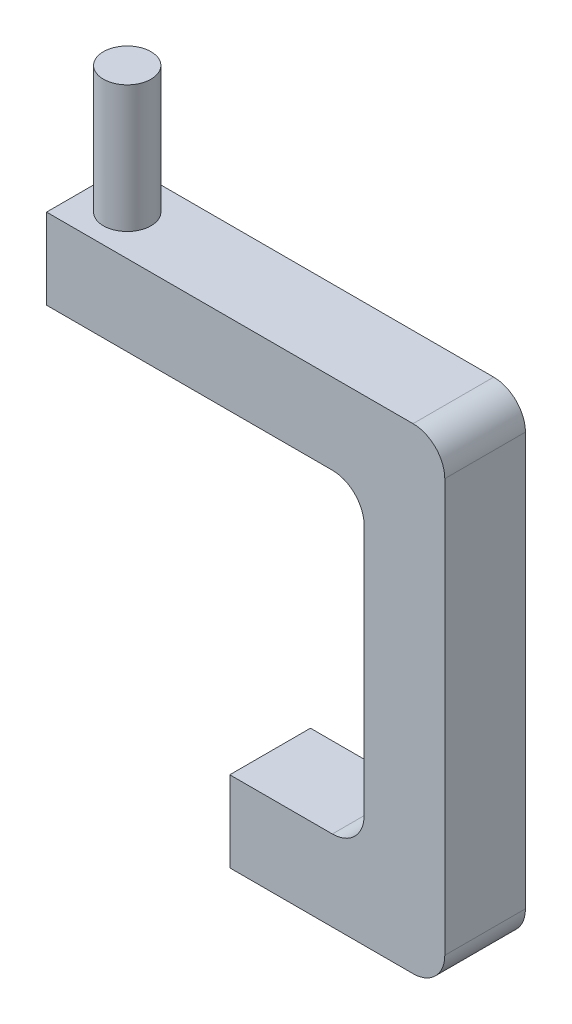
from build123d import *

# Parameters (mm, degrees)
SKETCH1_W           = 100
SKETCH1_H           = 25.4
SKETCH1_W_2         = 25.4
SKETCH1_H_2         = 150
SKETCH1_W_3         = 42.3
BOSS_EXTRUDE1_DEPTH = 25.4
BOSS_EXTRUDE2_DEPTH = 40
CUT_EXTRUDE2_DEPTH  = 30
FILLET1_R           = 10


with BuildPart() as part:
    # Sketch1 → Boss-Extrude1 (new body)
    with BuildSketch(Plane.XY):
        with Locations((-62.7, 62.3)):
            Rectangle(SKETCH1_W, SKETCH1_H)
        Rectangle(SKETCH1_W_2, SKETCH1_H_2)
        with Locations((-33.85, -62.3)):
            Rectangle(SKETCH1_W_3, SKETCH1_H)
    extrude(amount=BOSS_EXTRUDE1_DEPTH)

    # Sketch2 → Boss-Extrude2 (add)
    with BuildSketch(Plane(origin=(0, 75, 0), x_dir=(1, 0, 0), z_dir=(0, 1, 0))):
        with BuildLine():
            ThreePointArc((-94.696699141, -7.396699141), (-105.303300859, -7.396699141), (-105.303300859, -18.003300859))
            Line((-105.303300859, -18.003300859), (-94.696699141, -7.396699141))
        make_face()
        with BuildLine():
            Line((-94.696699141, -7.396699141), (-105.303300859, -18.003300859))
            ThreePointArc((-105.303300859, -18.003300859), (-97.129874257, -19.629096494), (-92.5, -12.7))
            ThreePointArc((-92.5, -12.7), (-93.070903506, -9.829874257), (-94.696699141, -7.396699141))
        make_face()
    extrude(amount=BOSS_EXTRUDE2_DEPTH)

    # Sketch3 → Cut-Extrude2 (cut)
    with BuildSketch(Plane.ZY.offset(55)):
        with BuildLine():
            ThreePointArc((20.2, -62.3), (19.629096494, -59.429874257), (18.003300859, -56.996699141))
            Line((18.003300859, -56.996699141), (7.396699141, -67.603300859))
            ThreePointArc((7.396699141, -67.603300859), (15.570125743, -69.229096494), (20.2, -62.3))
        make_face()
        with BuildLine():
            Line((7.396699141, -67.603300859), (18.003300859, -56.996699141))
            ThreePointArc((18.003300859, -56.996699141), (7.396699141, -56.996699141), (7.396699141, -67.603300859))
        make_face()
    extrude(amount=-CUT_EXTRUDE2_DEPTH, mode=Mode.SUBTRACT)

    # Fillet1
    fillet1_edges = [part.edges().sort_by_distance(p)[0] for p in [
        (12.7, 75, 12.7),
        (12.7, -75, 12.7),
        (-12.7, -49.6, 12.7),
        (-12.7, 49.6, 12.7),
    ]]
    fillet(fillet1_edges, radius=FILLET1_R)


solid = part.part
